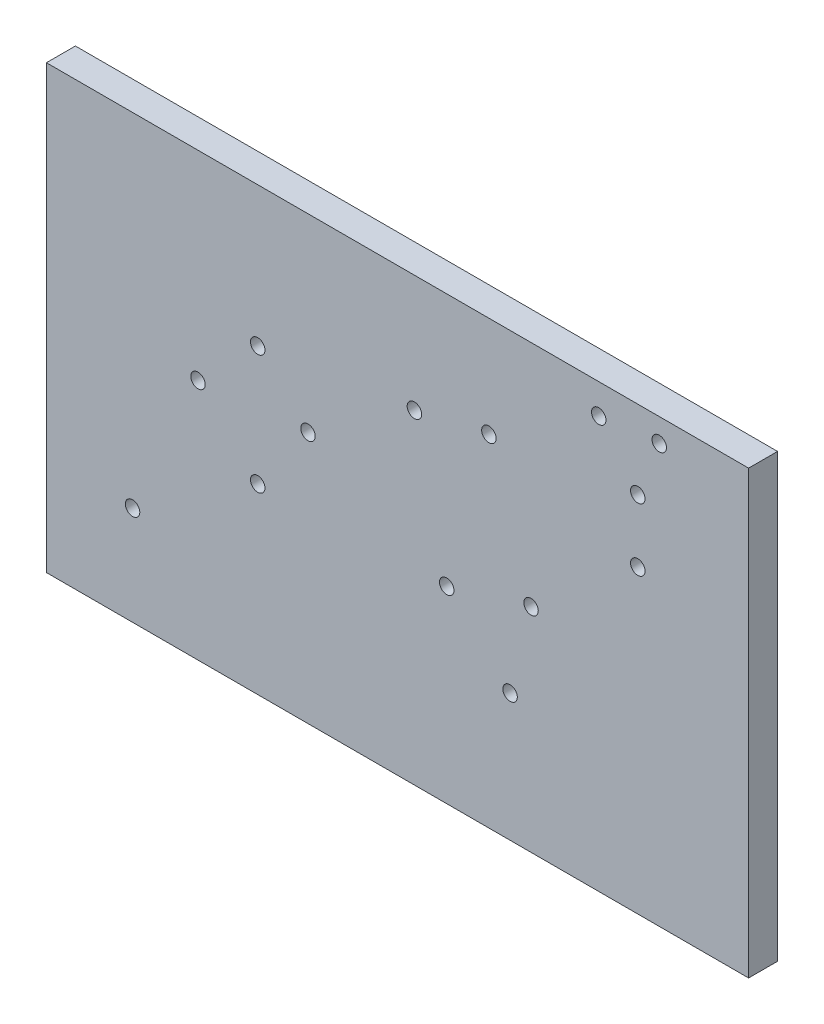
from build123d import *

# Parameters (mm, degrees)
BOSS_EXTRUDE1_DEPTH     = 12.7
CUT_EXTRUDE1_DEPTH      = 188.996466057
CUT_EXTRUDE1_DEPTH_BACK = 188.996466057
SKETCH3_R               = 3.175


with BuildPart() as part:
    # Sketch1 → Boss-Extrude1 (new body)
    with BuildSketch(Plane.XY):
        Polygon((155.575, -88.9), (-152.4, -88.9), (-152.4, 0), (-152.4, 104.775), (155.575, 104.775), (155.575, 0), align=None)
    extrude(amount=BOSS_EXTRUDE1_DEPTH)

    # Sketch3 → Cut-Extrude1 (cut, two sides: drawn at the far end of the back side and taken through both)
    with BuildSketch(Plane.XY.offset(12.7).offset(-CUT_EXTRUDE1_DEPTH_BACK)):
        with Locations((106.975954286, 70.395873002)):
            Circle(SKETCH3_R)
        with Locations((106.975954286, 42.900373002)):
            Circle(SKETCH3_R)
        with Locations((-59.73361009, 43.51546635)):
            Circle(SKETCH3_R)
        with Locations((-59.73361009, -8.87203365)):
            Circle(SKETCH3_R)
        with Locations((-85.92736009, 17.32171635)):
            Circle(SKETCH3_R)
        with Locations((-114.633914907, -45.510351778)):
            Circle(SKETCH3_R)
        with Locations((8.985545702, 53.468225166)):
            Circle(SKETCH3_R)
        with Locations((41.65587457, 60.657920909)):
            Circle(SKETCH3_R)
        with Locations((60.142975062, 4.412421641)):
            Circle(SKETCH3_R)
        with Locations((50.952707496, -32.969269828)):
            Circle(SKETCH3_R)
        with Locations((23.174346831, -6.319418914)):
            Circle(SKETCH3_R)
        with Locations((-37.672139706, 21.75002)):
            Circle(SKETCH3_R)
        with Locations((89.842754417, 91.683154931)):
            Circle(SKETCH3_R)
        with Locations((116.371246163, 94.499523115)):
            Circle(SKETCH3_R)
    extrude(amount=CUT_EXTRUDE1_DEPTH + CUT_EXTRUDE1_DEPTH_BACK, mode=Mode.SUBTRACT)


solid = part.part
